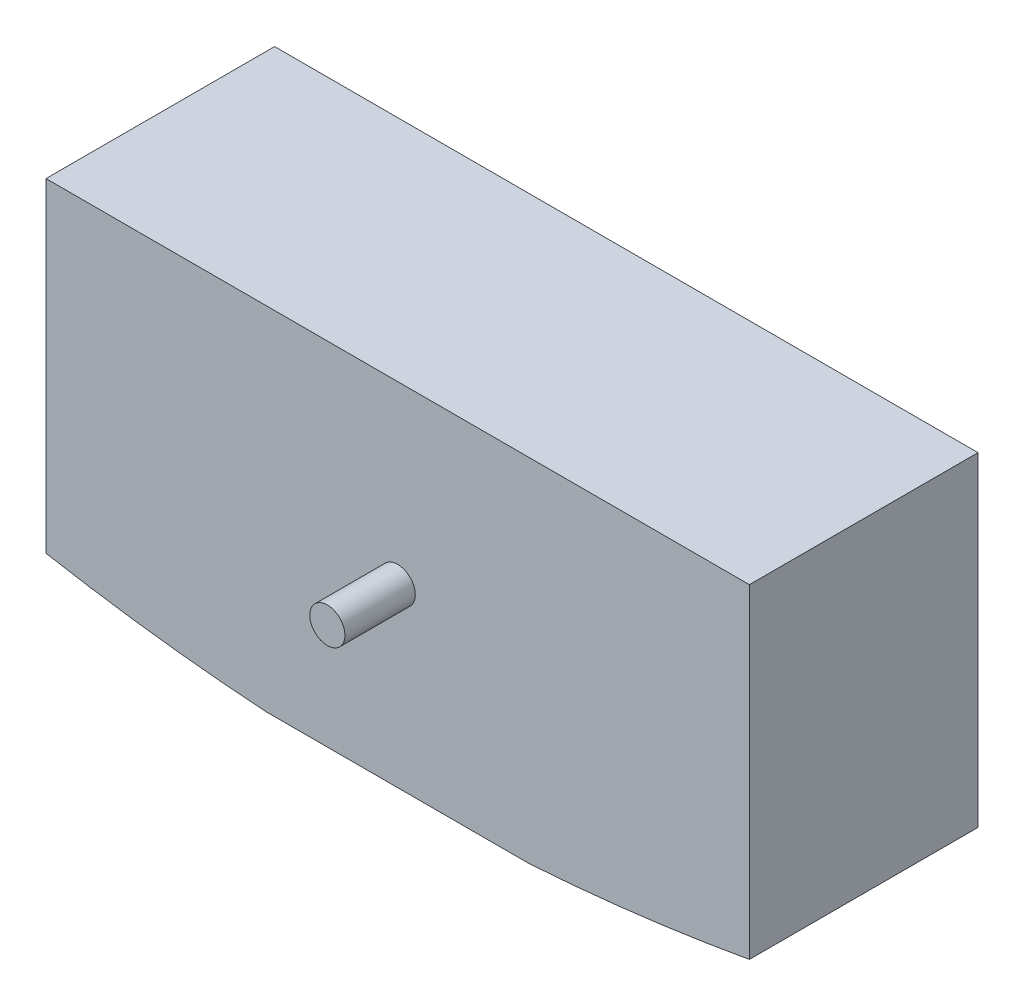
from build123d import *

# Parameters (mm, degrees)
BOSS_EXTRUDE1_DEPTH      = 50
BOSS_EXTRUDE1_DEPTH_BACK = 50
SKETCH2_W                = 200
SKETCH2_H                = 130
SKETCH4_R                = 5
BOSS_EXTRUDE2_DEPTH      = 20
CUT_EXTRUDE1_DEPTH       = 142
SKETCH8_W                = 269.720161695
SKETCH8_H                = 76.695766259
CUT_EXTRUDE3_DEPTH       = 142


with BuildPart() as part:
    # Sketch2 → Boss-Extrude1 (new, two sides: drawn at the far end of the back side and taken through both)
    with BuildSketch(Plane(origin=(0, 0, 0), x_dir=(1, 0, 0), z_dir=(0, 1, 0)).offset(-BOSS_EXTRUDE1_DEPTH_BACK)):
        Rectangle(SKETCH2_W, SKETCH2_H)
    extrude(amount=BOSS_EXTRUDE1_DEPTH + BOSS_EXTRUDE1_DEPTH_BACK)

    # Sketch4 → Boss-Extrude2 (add)
    with BuildSketch(Plane.XY.offset(65)):
        Circle(SKETCH4_R)
    extrude(amount=BOSS_EXTRUDE2_DEPTH)

    # Sketch6 → Revolve1 (revolve)
    with BuildSketch(Plane.ZY.offset(100)):
        with BuildLine():
            Line((-35, -5), (-35, 45))
            ThreePointArc((-35, 45), (-10, 20), (-35, -5))
        make_face()
    revolve1 = revolve(axis=Axis((-100, -5, -35), (0, 1, 0)))

    # Mirror1: Revolve1 across plane
    add(revolve1.mirror(Plane(origin=(0, 0, 0), x_dir=(0, 0, 1), z_dir=(1, 0, 0))))

    # Sketch7 → Cut-Extrude1 (cut)
    with BuildSketch(Plane(origin=(0, 0, -65), x_dir=(-1, 0, 0), z_dir=(0, 0, -1))):
        with BuildLine():
            ThreePointArc((-37.519288456, -50), (-68.867740428, -47.018454326), (-100, -42.285857823))
            Line((-100, -42.285857823), (-100, -50))
            Line((-100, -50), (-37.519288456, -50))
        make_face()
        with BuildLine():
            Line((100, -50), (100, -42.285857823))
            ThreePointArc((100, -42.285857823), (68.867740428, -47.018454326), (37.519288456, -50))
            Line((37.519288456, -50), (100, -50))
        make_face()
    extrude(amount=-CUT_EXTRUDE1_DEPTH, mode=Mode.SUBTRACT)

    # Sketch8 → Cut-Extrude3 (cut)
    with BuildSketch(Plane(origin=(0, 50, 0), x_dir=(1, 0, 0), z_dir=(0, 1, 0))):
        with Locations((-5.901213318, 38.34788313)):
            Rectangle(SKETCH8_W, SKETCH8_H)
    extrude(amount=-CUT_EXTRUDE3_DEPTH, mode=Mode.SUBTRACT)


solid = part.part
